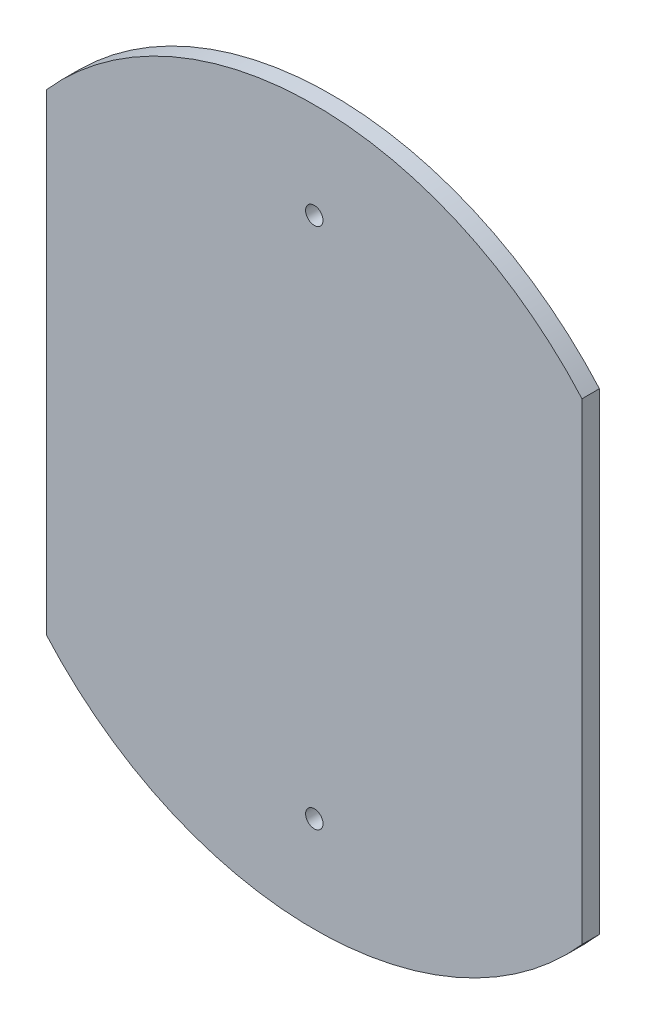
from build123d import *

# Parameters (mm, degrees)
SKETCH1_R               = 82
BOSS_EXTRUDE1_DEPTH     = 4
SKETCH2_R               = 2
CUT_EXTRUDE1_DEPTH      = 8
CIRPATTERN1_COUNT       = 2
CUT_EXTRUDE2_DEPTH      = 117.034477635
CUT_EXTRUDE2_DEPTH_BACK = 10


with BuildPart() as part:
    # Sketch1 → Boss-Extrude1 (new body)
    with BuildSketch(Plane.XY):
        Circle(SKETCH1_R)
    extrude(amount=BOSS_EXTRUDE1_DEPTH)

    # Sketch2 → Cut-Extrude1 (cut)
    with BuildSketch(Plane.XY.offset(4)):
        with Locations((0, 60)):
            Circle(SKETCH2_R)
    cut_extrude1 = extrude(amount=-CUT_EXTRUDE1_DEPTH, mode=Mode.SUBTRACT)

    # CirPattern1: Cut-Extrude1 ×2 about axis
    cirpattern1_axis = Axis((0, 0, 0), (0, 0, 1))
    for i in range(1, CIRPATTERN1_COUNT):
        add(cut_extrude1.rotate(cirpattern1_axis, i * 360 / CIRPATTERN1_COUNT), mode=Mode.SUBTRACT)

    # Sketch3 → Cut-Extrude2 (cut, two sides: drawn at the far end of the back side and taken through both)
    with BuildSketch(Plane.XY.offset(4).offset(-CUT_EXTRUDE2_DEPTH_BACK)):
        with BuildLine():
            ThreePointArc((-61.479450169, 54.261194301), (-82, 0), (-61.479450169, -54.261194301))
            Line((-61.479450169, -54.261194301), (-61.479450169, 54.261194301))
        make_face()
        with BuildLine():
            Line((61.479450169, 54.261194301), (61.479450169, 31.325344482))
            ThreePointArc((61.479450169, 31.325344482), (67.093524507, 16.107730106), (69, 0))
            Line((69, 0), (82, 0))
            ThreePointArc((82, 0), (76.698484059, 29.005905314), (61.479450169, 54.261194301))
        make_face()
        with BuildLine():
            Line((61.479450169, 0), (61.479450169, -31.325344482))
            ThreePointArc((61.479450169, -31.325344482), (67.093524507, -16.107730106), (69, 0))
            Line((69, 0), (61.479450169, 0))
        make_face()
        with BuildLine():
            ThreePointArc((69, 0), (67.093524507, 16.107730106), (61.479450169, 31.325344482))
            Line((61.479450169, 31.325344482), (61.479450169, 0))
            Line((61.479450169, 0), (69, 0))
        make_face()
        with BuildLine():
            ThreePointArc((69, 0), (67.093524507, -16.107730106), (61.479450169, -31.325344482))
            Line((61.479450169, -31.325344482), (73.062534983, -37.227220979))
            ThreePointArc((73.062534983, -37.227220979), (79.734333473, -19.142519836), (82, 0))
            Line((82, 0), (69, 0))
        make_face()
        with BuildLine():
            Line((73.062534983, -37.227220979), (61.479450169, -31.325344482))
            Line((61.479450169, -31.325344482), (61.479450169, -54.261194301))
            ThreePointArc((61.479450169, -54.261194301), (67.808004719, -46.109375359), (73.062534983, -37.227220979))
        make_face()
    extrude(amount=CUT_EXTRUDE2_DEPTH + CUT_EXTRUDE2_DEPTH_BACK, mode=Mode.SUBTRACT)


solid = part.part
